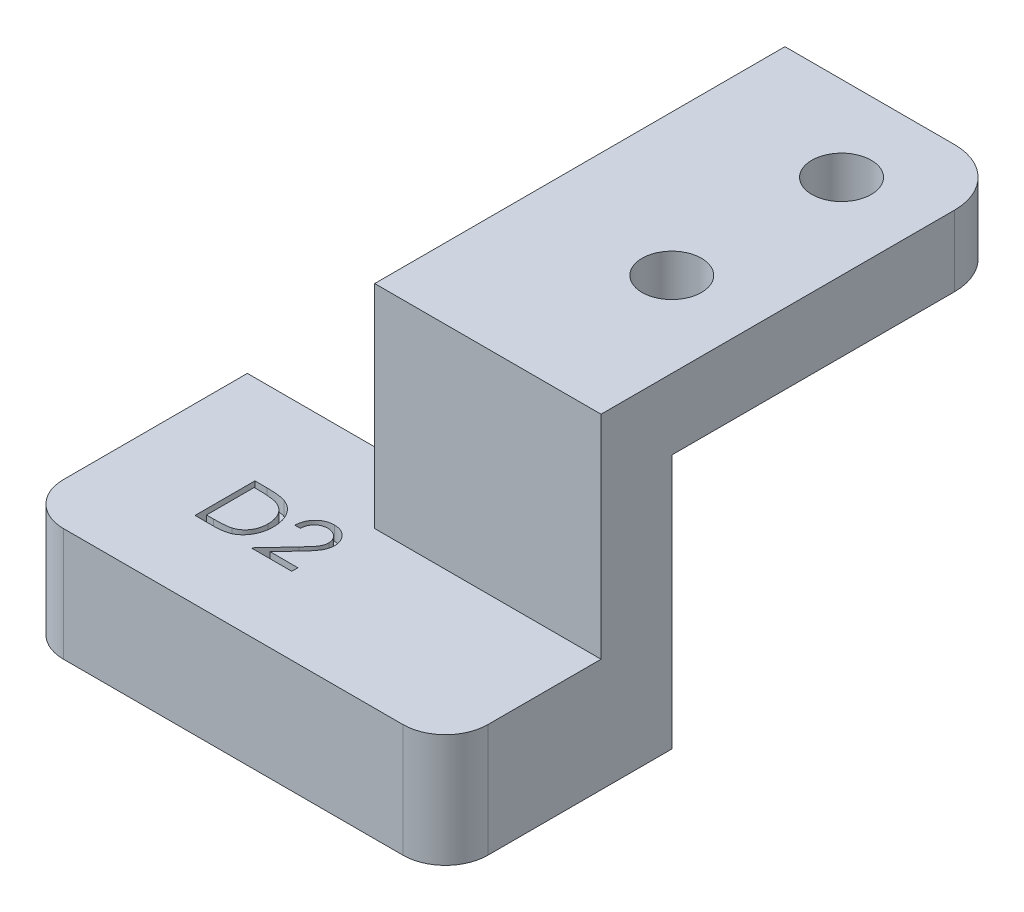
from build123d import *

# Parameters (mm, degrees)
SKETCH1_W           = 15
SKETCH1_H           = 8
BOSS_EXTRUDE1_DEPTH = 4
FILLET1_R           = 1.5
SKETCH10_W          = 7
SKETCH10_H          = 4
CUT_EXTRUDE2_DEPTH  = 7.5
SKETCH11_W          = 8
SKETCH11_H          = 2.5
BOSS_EXTRUDE4_DEPTH = 7.5
SKETCH12_W          = 8
SKETCH12_H          = 2.5
BOSS_EXTRUDE5_DEPTH = 12
FILLET2_R           = 2
SKETCH13_R          = 1.05
SKETCH13_R_2        = 1.049219919
CUT_EXTRUDE3_DEPTH  = 12
SKETCH14_W          = 8
SKETCH14_H          = 1.936154072
BOSS_EXTRUDE6_DEPTH = 7.5
SKETCH16_W          = 7
SKETCH16_H          = 4
BOSS_EXTRUDE7_DEPTH = 4
SKETCH17_W          = 1.936154072
SKETCH17_H          = 7.50023418
CUT_EXTRUDE4_DEPTH  = 8
CUT_EXTRUDE5_DEPTH  = 0.5


with BuildPart() as part:
    # Sketch1 → Boss-Extrude1 (new body)
    with BuildSketch(Plane(origin=(0, 0, 0), x_dir=(1, 0, 0), z_dir=(0, 1, 0))):
        Rectangle(SKETCH1_W, SKETCH1_H)
    extrude(amount=BOSS_EXTRUDE1_DEPTH)

    # Fillet1
    fillet1_edges = [part.edges().sort_by_distance(p)[0] for p in [
        (7.5, 2, 4),
        (-7.5, 2, 4),
    ]]
    fillet(fillet1_edges, radius=FILLET1_R)

    # Sketch10 → Cut-Extrude2 (cut)
    with BuildSketch(Plane(origin=(0, 4, 0), x_dir=(1, 0, 0), z_dir=(0, 1, 0))):
        with Locations((-4, 2)):
            Rectangle(SKETCH10_W, SKETCH10_H)
    extrude(amount=-CUT_EXTRUDE2_DEPTH, mode=Mode.SUBTRACT)

    # Sketch11 → Boss-Extrude4 (add)
    with BuildSketch(Plane(origin=(0, 4, 0), x_dir=(1, 0, 0), z_dir=(0, 1, 0))):
        with Locations((3.5, 2.75)):
            Rectangle(SKETCH11_W, SKETCH11_H)
    extrude(amount=BOSS_EXTRUDE4_DEPTH)

    # Sketch12 → Boss-Extrude5 (add)
    with BuildSketch(Plane(origin=(0, 0, -4), x_dir=(-1, 0, 0), z_dir=(0, 0, -1))):
        with Locations((-3.5, 10.25)):
            Rectangle(SKETCH12_W, SKETCH12_H)
    extrude(amount=BOSS_EXTRUDE5_DEPTH)

    # Fillet2
    fillet2_edges = [part.edges().sort_by_distance(p)[0] for p in [
        (7.5, 10.25, -16),
    ]]
    fillet(fillet2_edges, radius=FILLET2_R)

    # Sketch13 → Cut-Extrude3 (cut)
    with BuildSketch(Plane(origin=(0, 11.5, 0), x_dir=(1, 0, 0), z_dir=(0, 1, 0))):
        with Locations(Location((4.5, 13, 0), (0, 0, 270))):
            Circle(SKETCH13_R)
        with Locations(Location((4.5, 7, 0), (0, 0, 270))):
            Circle(SKETCH13_R_2)
    extrude(amount=-CUT_EXTRUDE3_DEPTH, mode=Mode.SUBTRACT)

    # Sketch14 → Boss-Extrude6 (add)
    with BuildSketch(Plane(origin=(0, 9, 0), x_dir=(-1, 0, 0), z_dir=(0, -1, 0))):
        with Locations((-3.5, 4.968077036)):
            Rectangle(SKETCH14_W, SKETCH14_H)
    extrude(amount=BOSS_EXTRUDE6_DEPTH)

    # Sketch16 → Boss-Extrude7 (add)
    with BuildSketch(Plane(origin=(0, 0, 0), x_dir=(-1, 0, 0), z_dir=(0, 0, -1))):
        with Locations((4, 2)):
            Rectangle(SKETCH16_W, SKETCH16_H)
    extrude(amount=BOSS_EXTRUDE7_DEPTH)

    # Sketch17 → Cut-Extrude4 (cut)
    with BuildSketch(Plane(origin=(7.5, 0, 0), x_dir=(0, 0, -1), z_dir=(1, 0, 0))):
        with Locations((4.968077036, 5.25011709)):
            Rectangle(SKETCH17_W, SKETCH17_H)
    extrude(amount=-CUT_EXTRUDE4_DEPTH, mode=Mode.SUBTRACT)

    # Sketch19 → Cut-Extrude5 (cut)
    # profile 1 of 2: a face of its own
    with BuildSketch(Plane(origin=(0, 4, 0), x_dir=(1, 0, 0), z_dir=(0, 1, 0))):
        with BuildLine():
            Line((-4.076318052, -1.273977892), (-4.076318052, 0.842688775))
            Line((-4.076318052, 0.842688775), (-3.648914206, 0.842688775))
            add(Edge.make_bspline(
                [(-3.648914206, 0.842688775), (-3.611740103, 0.842421125), (-3.539919931, 0.841904028), (-3.43613526, 0.838625377), (-3.34010889, 0.832825428), (-3.252156637, 0.824377191), (-3.172037047, 0.81400369), (-3.09997446, 0.801001064), (-3.035596259, 0.785647266), (-2.996002835, 0.772556922), (-2.97727959, 0.766366659)],
                knots=[0, 0, 0, 0, 1.314313732, 2.53924729, 3.670748893, 4.714932338, 5.66265055, 6.526160246, 7.303039223, 8, 8, 8, 8], degree=3))
            add(Edge.make_bspline(
                [(-2.97727959, 0.766366659), (-2.952789915, 0.757034756), (-2.904365908, 0.738582567), (-2.835418743, 0.703774708), (-2.770512452, 0.664336309), (-2.709298969, 0.620215382), (-2.653176565, 0.570162657), (-2.599952742, 0.516304325), (-2.55180479, 0.456681852), (-2.50771263, 0.39253174), (-2.467958207, 0.32460969), (-2.433402621, 0.253045124), (-2.404704254, 0.178201479), (-2.380880731, 0.10028689), (-2.362105016, 0.019130033), (-2.349294991, -0.065363591), (-2.340845868, -0.152860053), (-2.339996751, -0.212232229), (-2.339565915, -0.242357299)],
                knots=[0, 0, 0, 0, 0.984719456, 1.947108742, 2.898477687, 3.838006223, 4.779231079, 5.722358779, 6.681677486, 7.655904652, 8.64651281, 9.637519902, 10.640069247, 11.656948941, 12.698408672, 13.768548281, 14.867775369, 16, 16, 16, 16], degree=3))
            add(Edge.make_bspline(
                [(-2.339565915, -0.242357299), (-2.339946291, -0.268520048), (-2.34069586, -0.320076478), (-2.347426447, -0.396059305), (-2.357209269, -0.469787989), (-2.372355046, -0.540911436), (-2.390741327, -0.610052787), (-2.414305362, -0.676475144), (-2.441299209, -0.740787829), (-2.472776993, -0.802121255), (-2.507333926, -0.860228818), (-2.54441898, -0.915005447), (-2.583992601, -0.965669509), (-2.62643215, -1.012374432), (-2.671189198, -1.055049806), (-2.718556769, -1.09405212), (-2.76865709, -1.128618227), (-2.821265765, -1.16010643), (-2.87791752, -1.187574931), (-2.939685401, -1.210815937), (-3.006832827, -1.230075557), (-3.079194982, -1.246144622), (-3.156896895, -1.258891372), (-3.240014746, -1.267434476), (-3.328420831, -1.273211726), (-3.389126386, -1.273717544), (-3.420371871, -1.273977892)],
                knots=[0, 0, 0, 0, 1.105936401, 2.179363191, 3.223086493, 4.248585256, 5.251745608, 6.245858792, 7.225916811, 8.198733463, 9.158002045, 10.082870192, 10.993790845, 11.873723703, 12.748670949, 13.606408763, 14.465103618, 15.319838547, 16.196477973, 17.123216899, 18.106603292, 19.147568657, 20.255746949, 21.433717677, 22.679120308, 24, 24, 24, 24], degree=3))
            Line((-3.420371871, -1.273977892), (-4.076318052, -1.273977892))
        make_face()
        with BuildLine():
            Line((-3.886360787, -1.056883875), (-3.643402053, -1.056883875))
            add(Edge.make_bspline(
                [(-3.643402053, -1.056883875), (-3.608490133, -1.056733836), (-3.541341727, -1.056445255), (-3.444786652, -1.053912994), (-3.35656435, -1.049775251), (-3.276662295, -1.043984609), (-3.205125599, -1.036323113), (-3.14180476, -1.02778091), (-3.086907342, -1.017138642), (-3.053688111, -1.00749211), (-3.038337282, -1.003034383)],
                knots=[0, 0, 0, 0, 1.375205317, 2.645023457, 3.804390687, 4.853969522, 5.800190428, 6.637939096, 7.370582563, 8, 8, 8, 8], degree=3))
            add(Edge.make_bspline(
                [(-3.038337282, -1.003034383), (-3.01901613, -0.996229869), (-2.980835311, -0.982783367), (-2.925873893, -0.958255638), (-2.874616085, -0.929201625), (-2.826168594, -0.896905964), (-2.781218664, -0.860229572), (-2.739233603, -0.819969974), (-2.700297942, -0.775922277), (-2.664813956, -0.728141151), (-2.633058934, -0.676923988), (-2.605559667, -0.622774313), (-2.581458979, -0.566285432), (-2.562542877, -0.506589894), (-2.547716786, -0.444221368), (-2.537215284, -0.379175467), (-2.530674951, -0.31146434), (-2.529912075, -0.265410436), (-2.52952318, -0.241933287)],
                knots=[0, 0, 0, 0, 0.998632004, 1.973411704, 2.929992603, 3.868527914, 4.809262121, 5.754881198, 6.702106254, 7.672490631, 8.653608572, 9.636854334, 10.631411391, 11.644891563, 12.686317036, 13.754757253, 14.855430412, 16, 16, 16, 16], degree=3))
            add(Edge.make_bspline(
                [(-2.52952318, -0.241933287), (-2.529833597, -0.217178278), (-2.530443413, -0.168546843), (-2.538108353, -0.097190565), (-2.549309484, -0.028561791), (-2.565507237, 0.03734407), (-2.586148292, 0.100655598), (-2.611907909, 0.161022635), (-2.641339626, 0.219082722), (-2.676357359, 0.273495791), (-2.714708694, 0.324956862), (-2.757270554, 0.372101025), (-2.803366739, 0.415035673), (-2.852494482, 0.454429448), (-2.906038346, 0.488697481), (-2.962737007, 0.519350854), (-3.023422246, 0.545365227), (-3.065642305, 0.559201491), (-3.087098634, 0.566233112)],
                knots=[0, 0, 0, 0, 1.122418816, 2.205001699, 3.251619955, 4.274784885, 5.280384055, 6.268708349, 7.249350384, 8.229342522, 9.199999885, 10.157847722, 11.105861043, 12.055065948, 13.010012805, 13.98527497, 14.976112212, 16, 16, 16, 16], degree=3))
            add(Edge.make_bspline(
                [(-3.087098634, 0.566233112), (-3.104849089, 0.571141618), (-3.142591427, 0.58157845), (-3.204180055, 0.592963318), (-3.273494931, 0.603005086), (-3.350843798, 0.611506853), (-3.436138485, 0.617607281), (-3.529444592, 0.622186123), (-3.630802448, 0.62527442), (-3.701065219, 0.625485305), (-3.737532662, 0.625594757)],
                knots=[0, 0, 0, 0, 0.674548936, 1.434276114, 2.292660221, 3.240891867, 4.284742987, 5.42552168, 6.663806718, 8, 8, 8, 8], degree=3))
            Line((-3.737532662, 0.625594757), (-3.886360787, 0.625594757))
            Line((-3.886360787, 0.625594757), (-3.886360787, -1.056883875))
        make_face(mode=Mode.SUBTRACT)
    # profile 2 of 2: a face of its own
    with BuildSketch(Plane(origin=(0, 4, 0), x_dir=(1, 0, 0), z_dir=(0, 1, 0))):
        with BuildLine():
            Line((-1.823967624, 0.191406723), (-2.013924889, 0.191406723))
            add(Edge.make_bspline(
                [(-2.013924889, 0.191406723), (-2.012686849, 0.216607689), (-2.010255371, 0.266101714), (-1.998868739, 0.338264267), (-1.982575923, 0.407240264), (-1.959539663, 0.472475879), (-1.930930628, 0.53454792), (-1.896622469, 0.593209834), (-1.855986188, 0.648237838), (-1.809899258, 0.699121806), (-1.759843938, 0.745801908), (-1.705835108, 0.78611246), (-1.649081211, 0.820171242), (-1.589754431, 0.848644183), (-1.527185424, 0.870016376), (-1.461941981, 0.885874224), (-1.393737456, 0.895415157), (-1.347267538, 0.896440704), (-1.323633757, 0.896962279)],
                knots=[0, 0, 0, 0, 1.10065271, 2.161652631, 3.183658789, 4.190468796, 5.17591951, 6.163126047, 7.15150782, 8.156236427, 9.156009102, 10.134482811, 11.092018607, 12.041330605, 13.001268258, 13.972401359, 14.968799086, 16, 16, 16, 16], degree=3))
            add(Edge.make_bspline(
                [(-1.323633757, 0.896962279), (-1.30042416, 0.896418927), (-1.25481813, 0.895351259), (-1.188256817, 0.886182446), (-1.124891501, 0.871822017), (-1.064846042, 0.851674122), (-1.008599517, 0.824590206), (-0.95572939, 0.792055504), (-0.905606233, 0.754427321), (-0.860486893, 0.710126205), (-0.819055816, 0.662832382), (-0.783313024, 0.612342078), (-0.75270411, 0.560193891), (-0.727190609, 0.505990169), (-0.708409039, 0.449220547), (-0.694149837, 0.390711525), (-0.686089925, 0.329857472), (-0.684852931, 0.288669222), (-0.684224035, 0.267728839)],
                knots=[0, 0, 0, 0, 1.111607364, 2.184268762, 3.212621178, 4.221274766, 5.211760367, 6.196651075, 7.1921475, 8.207485113, 9.220403448, 10.201281604, 11.166441695, 12.114753415, 13.065576456, 14.026450734, 14.996634279, 16, 16, 16, 16], degree=3))
            add(Edge.make_bspline(
                [(-0.684224035, 0.267728839), (-0.685248055, 0.238248005), (-0.687278127, 0.179803686), (-0.704643488, 0.093918507), (-0.73176495, 0.010707249), (-0.764420494, -0.056262453), (-0.797363353, -0.110227471), (-0.827049608, -0.154658545), (-0.861802136, -0.202498519), (-0.902126752, -0.253587194), (-0.947189298, -0.308324741), (-0.99739794, -0.366678094), (-1.053110712, -0.428044355), (-1.09221371, -0.469957742), (-1.112475904, -0.491676209)],
                knots=[0, 0, 0, 0, 1.184426356, 2.348067706, 3.509069118, 4.696110526, 5.333549288, 6.050745305, 6.844228056, 7.710549037, 8.667450064, 9.695053472, 10.805634456, 12, 12, 12, 12], degree=3))
            Line((-1.112475904, -0.491676209), (-1.642066583, -1.056883875))
            Line((-1.642066583, -1.056883875), (-0.657087282, -1.056883875))
            Line((-0.657087282, -1.056883875), (-0.657087282, -1.273977892))
            Line((-0.657087282, -1.273977892), (-2.095335146, -1.273977892))
            Line((-2.095335146, -1.273977892), (-1.274448394, -0.397969612))
            add(Edge.make_bspline(
                [(-1.274448394, -0.397969612), (-1.254462291, -0.377106351), (-1.216073077, -0.337032295), (-1.161775995, -0.278525838), (-1.113008607, -0.224248735), (-1.069455231, -0.174303537), (-1.032060683, -0.127959684), (-0.998876047, -0.086718125), (-0.972287333, -0.048766624), (-0.943430879, -0.004775872), (-0.915482424, 0.048934434), (-0.891465903, 0.114571475), (-0.876821686, 0.182139861), (-0.875064952, 0.227800617), (-0.8741813, 0.250768369)],
                knots=[0, 0, 0, 0, 1.329631726, 2.553950428, 3.673215718, 4.687767853, 5.603093632, 6.413772471, 7.123043292, 7.734684054, 8.834405432, 9.900288307, 10.943827018, 12, 12, 12, 12], degree=3))
            add(Edge.make_bspline(
                [(-0.8741813, 0.250768369), (-0.874565772, 0.265210929), (-0.875323494, 0.293674441), (-0.882010768, 0.335406495), (-0.892116646, 0.375662359), (-0.906597826, 0.414565857), (-0.925712378, 0.451725847), (-0.948979613, 0.487187561), (-0.975825032, 0.521470887), (-1.006880323, 0.553615977), (-1.040995862, 0.583056516), (-1.077036193, 0.60913632), (-1.115166495, 0.630931401), (-1.155225997, 0.648798183), (-1.197103019, 0.66281377), (-1.240878555, 0.672525387), (-1.286431651, 0.67862289), (-1.31753667, 0.679447889), (-1.333386027, 0.679868262)],
                knots=[0, 0, 0, 0, 0.991446411, 1.95395049, 2.89581595, 3.838931463, 4.798493298, 5.75982156, 6.748411868, 7.785213223, 8.824556874, 9.840280684, 10.836137867, 11.835679398, 12.848801643, 13.863922112, 14.911575587, 16, 16, 16, 16], degree=3))
            add(Edge.make_bspline(
                [(-1.333386027, 0.679868262), (-1.349938864, 0.679435837), (-1.382445903, 0.678586628), (-1.430173127, 0.672646255), (-1.475703098, 0.662398056), (-1.519150344, 0.648381686), (-1.560588379, 0.630566278), (-1.599815682, 0.608376509), (-1.636744191, 0.58189792), (-1.671443327, 0.551877202), (-1.703413447, 0.518453463), (-1.731502748, 0.481194104), (-1.756046414, 0.440779429), (-1.77746057, 0.397318487), (-1.794850915, 0.350416915), (-1.80813944, 0.300241208), (-1.818654342, 0.247009229), (-1.822167114, 0.210248726), (-1.823967624, 0.191406723)],
                knots=[0, 0, 0, 0, 1.031018746, 2.02475058, 2.990194455, 3.934040569, 4.864654155, 5.795059489, 6.735614925, 7.690564532, 8.649604399, 9.611025574, 10.590972636, 11.591080095, 12.624614302, 13.701020113, 14.821632451, 16, 16, 16, 16], degree=3))
        make_face()
    extrude(amount=-CUT_EXTRUDE5_DEPTH, mode=Mode.SUBTRACT)


solid = part.part
